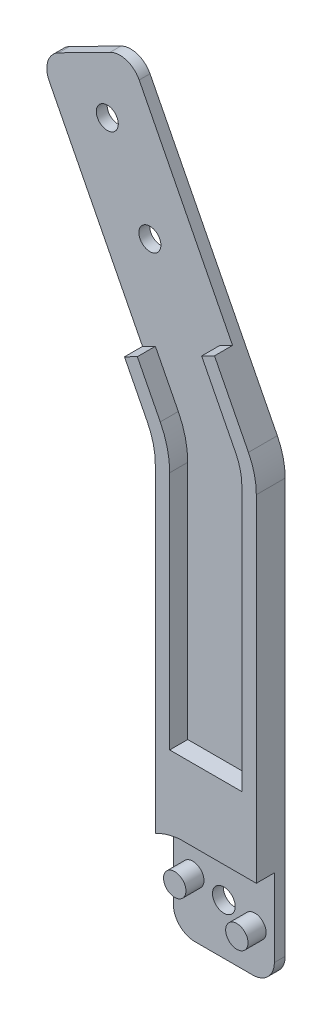
from build123d import *
from OCP.BRepFilletAPI import BRepFilletAPI_MakeFillet

# Parameters (mm, degrees)
SCHIZZO2_R                   = 1.575
SCHIZZO2_R_2                 = 1.525
ESTRUSIONE_ESTRUSIONE1_DEPTH = 1.5
RACCORDO1_R1                 = 3
RACCORDO1_R2                 = 10
ESTRUSIONE_ESTRUSIONE2_START = -1.5
SCHIZZO4_R                   = 1.55
ESTRUSIONE_ESTRUSIONE2_DEPTH = 2.5
ESTRUSIONE_ESTRUSIONE3_START = 2.5
ESTRUSIONE_ESTRUSIONE3_DEPTH = 2.5


with BuildPart() as part:
    # Schizzo2 → Estrusione-Estrusione1 (new body)
    with BuildSketch(Plane.XY):
        Polygon((10.835450111, 45.456844872), (10.835450111, 104.878132603), (-7.726239407, 141.30749945), (4.747851932, 147.663366447), (24.835450111, 108.23923523), (24.835450111, 45.456844872), align=None)
        with Locations((17.835450111, 52.456844872)):
            Circle(SCHIZZO2_R, mode=Mode.SUBTRACT)
        with Locations((1.688739761, 138.248387279)):
            Circle(SCHIZZO2_R_2, mode=Mode.SUBTRACT)
        with Locations((7.590616257, 126.665302465)):
            Circle(SCHIZZO2_R_2, mode=Mode.SUBTRACT)
    extrude(amount=ESTRUSIONE_ESTRUSIONE1_DEPTH)

    # Raccordo1: one fillet with a radius per group of edges: ONE call of the kernel's fillet builder (fillet() takes one radius for all edges)
    raccordo1_edges_1 = [part.edges().sort_by_distance(p)[0] for p in [
        (4.747851932, 147.663366447, 0.75),
        (-7.726239407, 141.30749945, 0.75),
        (10.835450111, 45.456844872, 0.75),
        (24.835450111, 45.456844872, 0.75),
    ]]
    raccordo1_edges_2 = [part.edges().sort_by_distance(p)[0] for p in [
        (24.835450111, 108.23923523, 0.75),
        (10.835450111, 104.878132603, 0.75),
    ]]
    raccordo1 = BRepFilletAPI_MakeFillet(part.part.solid().wrapped)
    for e in raccordo1_edges_1:
        raccordo1.Add(RACCORDO1_R1, e.wrapped)
    for e in raccordo1_edges_2:
        raccordo1.Add(RACCORDO1_R2, e.wrapped)
    add(Compound.cast(raccordo1.Shape()), mode=Mode.REPLACE)

    # Schizzo4 → Estrusione-Estrusione2 (add)
    with BuildSketch(Plane(origin=(0, 0, 0), x_dir=(-1, 0, 0), z_dir=(0, 0, -1)).offset(ESTRUSIONE_ESTRUSIONE2_START)):
        with Locations(Location((-13.532140626, 53.421016786, 0), (0, 0, 180))):
            Circle(SCHIZZO4_R)
        with Locations(Location((-22.138759596, 51.492672958, 0), (0, 0, 180))):
            Circle(SCHIZZO4_R)
    extrude(amount=-ESTRUSIONE_ESTRUSIONE2_DEPTH)

    # Schizzo5 → Estrusione-Estrusione3 (add)
    with BuildSketch(Plane.XY.offset(1.5).offset(ESTRUSIONE_ESTRUSIONE3_START)):
        with BuildLine():
            Line((24.835450111, 59.217112451), (14.402001203, 59.217112451))
            add(Edge.make_bspline(
                [(14.402001203, 59.217112451), (13.28177849, 59.164141407), (11.913165696, 58.833942628), (10.835450111, 58.162340852)],
                knots=[0, 0, 0, 0, 0.33692331, 0.33692331, 0.33692331, 0.33692331], degree=3))
            Line((10.835450111, 58.162340852), (10.835450111, 102.477345012))
            ThreePointArc((10.835450111, 102.477345012), (10.559149315, 104.811798651), (9.745515353, 107.01725001))
            Line((9.745515353, 107.01725001), (6.567581855, 113.254295679))
            Line((6.567581855, 113.254295679), (8.349594903, 114.162276678))
            Line((8.349594903, 114.162276678), (11.527528401, 107.925231009))
            ThreePointArc((11.527528401, 107.925231009), (12.503889156, 105.278689378), (12.835450111, 102.477345012))
            Line((12.835450111, 102.477345012), (12.835450111, 69.217112451))
            Line((12.835450111, 69.217112451), (22.835450111, 69.217112451))
            Line((22.835450111, 69.217112451), (22.835450111, 105.838447639))
            ThreePointArc((22.835450111, 105.838447639), (22.614409474, 107.70601055), (21.963502304, 109.470371637))
            Line((21.963502304, 109.470371637), (17.259660145, 118.702181676))
            Line((17.259660145, 118.702181676), (19.041673193, 119.610162675))
            Line((19.041673193, 119.610162675), (23.745515353, 110.378352637))
            ThreePointArc((23.745515353, 110.378352637), (24.559149315, 108.172901278), (24.835450111, 105.838447639))
            Line((24.835450111, 105.838447639), (24.835450111, 59.217112451))
        make_face()
    extrude(amount=-ESTRUSIONE_ESTRUSIONE3_DEPTH)


solid = part.part
